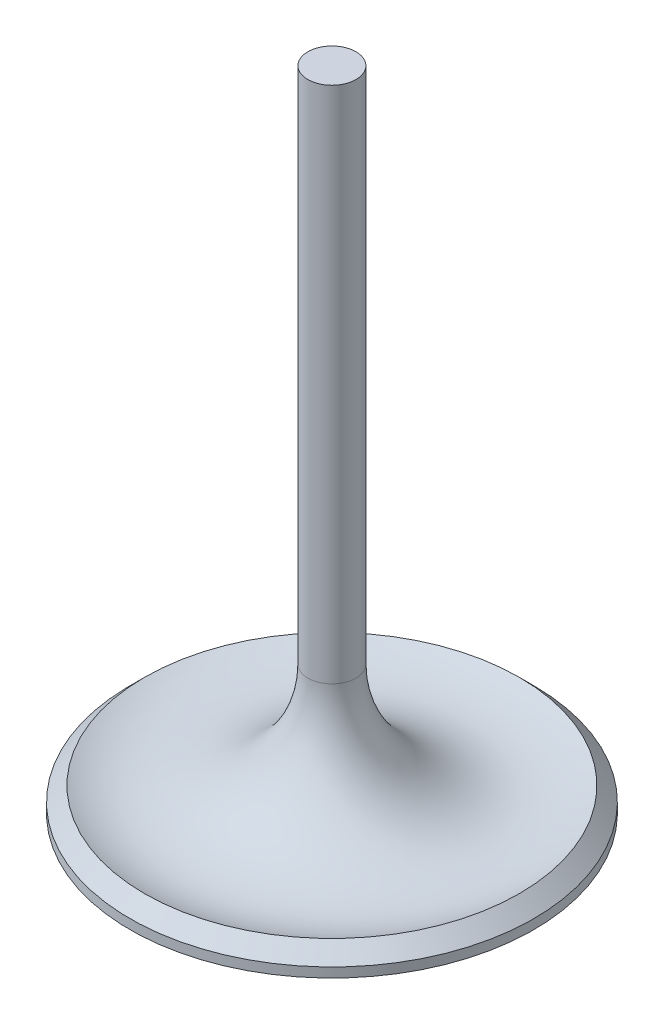
from build123d import *


with BuildPart() as part:
    # Sketch1 → Revolve1 (revolve)
    with BuildSketch(Plane.XY, mode=Mode.PRIVATE) as revolve1_sk:
        with BuildLine():
            Line((0, 0), (0, 85.55))
            Line((0, 85.55), (3.18, 85.55))
            Line((3.18, 85.55), (3.18, 17.054206284))
            ThreePointArc((3.18, 17.054206284), (10.18287929, 4.226599336), (24.76, 3.18))
            Line((24.76, 3.18), (26.67, 1.27))
            Line((26.67, 1.27), (26.67, 0))
            Line((26.67, 0), (0, 0))
        make_face()
    revolve(revolve1_sk.sketch.rotate(Axis((0, 0, 0), (0, 1, 0)), 90), axis=Axis((0, 0, 0), (0, 1, 0)))


solid = part.part
